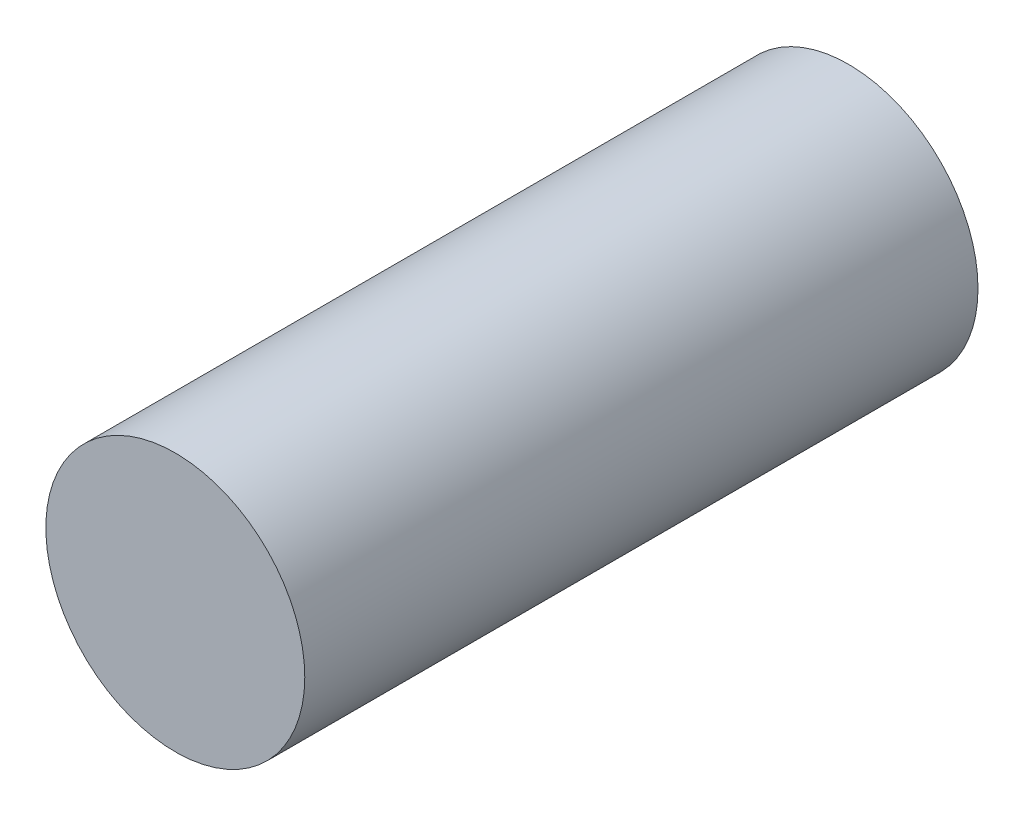
from build123d import *

# Parameters (mm, degrees)
SKETCH_1_R          = 2.5
EXTRUDE_1_DEPTH     = 20
CUT_EXTRUDE_START   = -7
SKETCH_2_R          = 2.5
CUT_EXTRUDE_1_DEPTH = 7


with BuildPart() as part:
    # 草图1 → 凸台-拉伸1 (new body)
    with BuildSketch(Plane.XY):
        Circle(SKETCH_1_R)
    extrude(amount=EXTRUDE_1_DEPTH)

    # 草图2 → 切除-拉伸1 (cut)
    with BuildSketch(Plane.XY.offset(20).offset(CUT_EXTRUDE_START)):
        Circle(SKETCH_2_R)
    extrude(amount=CUT_EXTRUDE_1_DEPTH, mode=Mode.SUBTRACT)


solid = part.part
